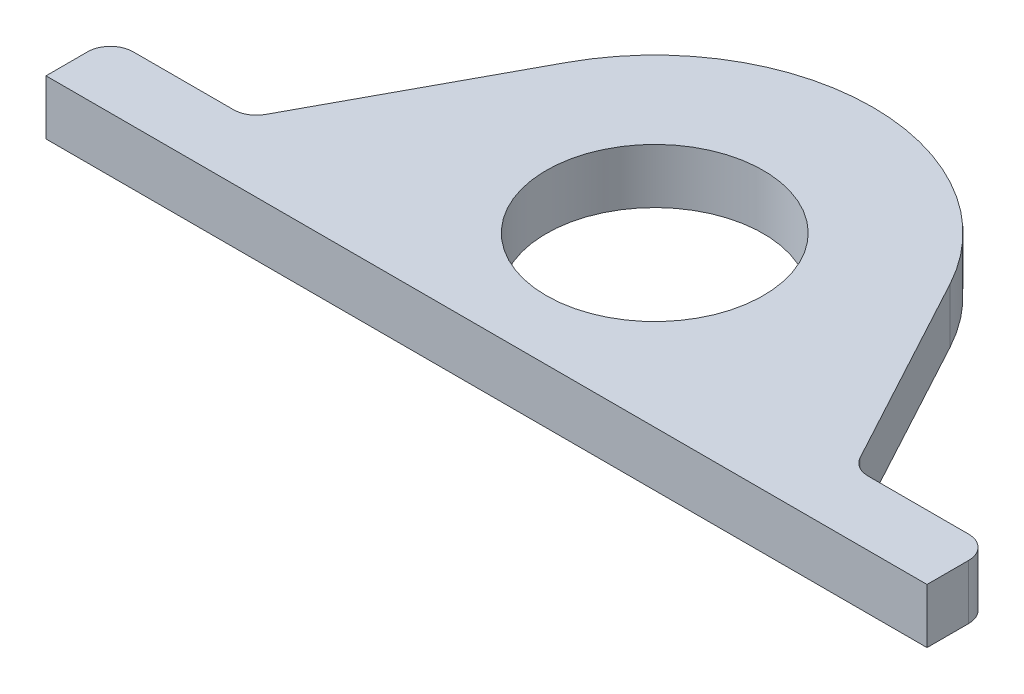
from build123d import *

# Parameters (mm, degrees)
SKETCH1_R           = 23.8
BOSS_EXTRUDE1_DEPTH = 12
SKETCH2_W           = 268.538723742
SKETCH2_H           = 56.355455055
CUT_EXTRUDE1_DEPTH  = 26


with BuildPart() as part:
    # Sketch1 → Boss-Extrude1 (new body)
    with BuildSketch(Plane(origin=(0, 0, 0), x_dir=(1, 0, 0), z_dir=(0, 1, 0))):
        with BuildLine():
            Line((65, -39.8), (-65, -39.8))
            Line((-65, -39.8), (-96.605676951, -39.8))
            Line((-96.605676951, -39.8), (-96.605676951, -27.775552827))
            ThreePointArc((-96.605676951, -27.775552827), (-95.141210857, -24.240018922), (-91.605676951, -22.775552827))
            Line((-91.605676951, -22.775552827), (-69.589095412, -22.775552827))
            ThreePointArc((-69.589095412, -22.775552827), (-67.027094411, -22.069286735), (-65.188875184, -20.150013174))
            Line((-65.188875184, -20.150013174), (-42.066105387, 22.699840916))
            ThreePointArc((-42.066105387, 22.699840916), (0, 47.8), (42.066105387, 22.699840916))
            Line((42.066105387, 22.699840916), (65.188875184, -20.150013174))
            ThreePointArc((65.188875184, -20.150013174), (67.027094411, -22.069286735), (69.589095412, -22.775552827))
            Line((69.589095412, -22.775552827), (91.605676951, -22.775552827))
            ThreePointArc((91.605676951, -22.775552827), (95.141210857, -24.240018922), (96.605676951, -27.775552827))
            Line((96.605676951, -27.775552827), (96.605676951, -39.8))
            Line((96.605676951, -39.8), (65, -39.8))
        make_face()
        with Locations(Location((0, 0, 0), (0, 0, 270))):
            Circle(SKETCH1_R, mode=Mode.SUBTRACT)
    extrude(amount=BOSS_EXTRUDE1_DEPTH)

    # Sketch2 → Cut-Extrude1 (cut)
    with BuildSketch(Plane.XZ):
        with Locations((-8.696253547, 65.077727528)):
            Rectangle(SKETCH2_W, SKETCH2_H)
    extrude(amount=-CUT_EXTRUDE1_DEPTH, mode=Mode.SUBTRACT)


solid = part.part
